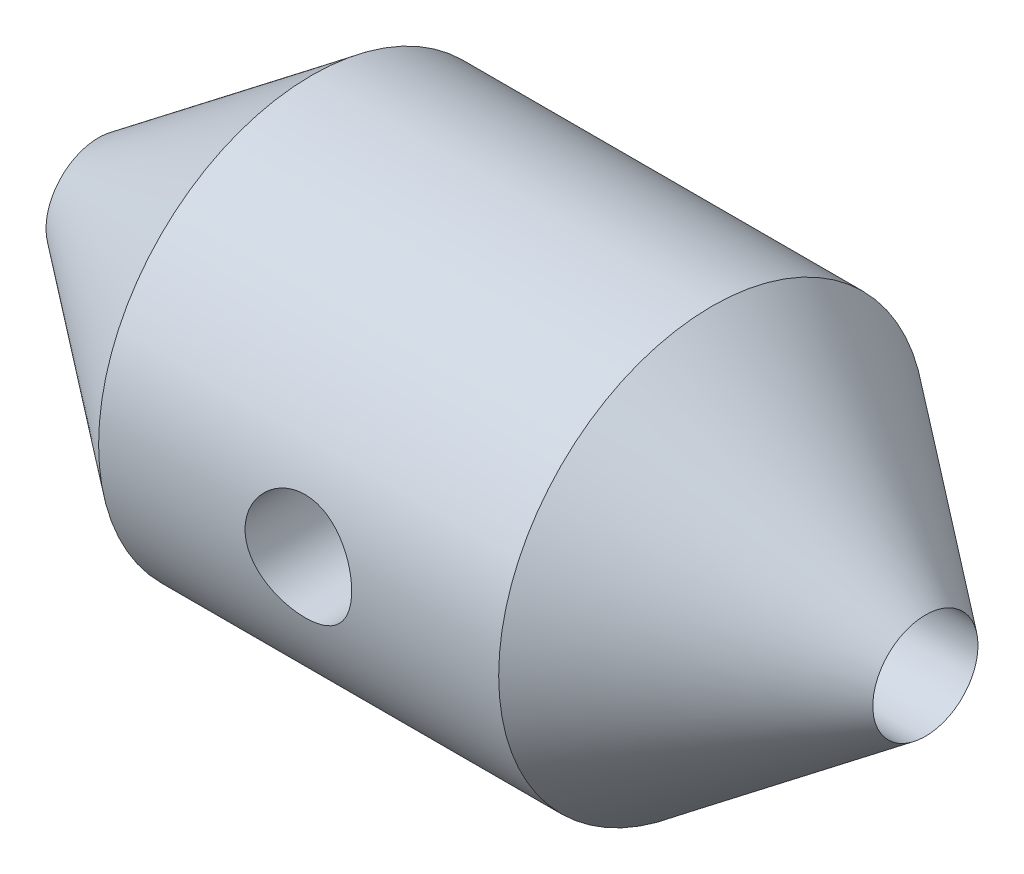
from build123d import *

# Parameters (mm, degrees)
SKETCH1_R           = 101.6
SKETCH1_R_2         = 25.4
BOSS_EXTRUDE1_DEPTH = 190.5
SKETCH2_R           = 101.6
BOSS_EXTRUDE2_DEPTH = 101.6
BOSS_EXTRUDE2_TAPER = 37
SKETCH3_R           = 101.6
BOSS_EXTRUDE3_DEPTH = 101.6
BOSS_EXTRUDE3_TAPER = 37
SKETCH4_R           = 25.03890851
CUT_EXTRUDE1_DEPTH  = 453.39
SKETCH5_R           = 25.4
CUT_EXTRUDE3_DEPTH  = 351.79


with BuildPart() as part:
    # Sketch1 → Boss-Extrude1 (new body)
    with BuildSketch(Plane(origin=(0, 0, 0), x_dir=(0, 0, -1), z_dir=(1, 0, 0))):
        Circle(SKETCH1_R)
        Circle(SKETCH1_R_2, mode=Mode.SUBTRACT)
    extrude(amount=BOSS_EXTRUDE1_DEPTH)

    # Sketch2 → Boss-Extrude2 (add)
    with BuildSketch(Plane(origin=(190.5, 0, 0), x_dir=(0, 0, -1), z_dir=(1, 0, 0))):
        Circle(SKETCH2_R)
    extrude(amount=BOSS_EXTRUDE2_DEPTH, taper=BOSS_EXTRUDE2_TAPER)

    # Sketch3 → Boss-Extrude3 (add)
    with BuildSketch(Plane.ZY):
        Circle(SKETCH3_R)
    extrude(amount=BOSS_EXTRUDE3_DEPTH, taper=BOSS_EXTRUDE3_TAPER)

    # Sketch4 → Cut-Extrude1 (cut)
    with BuildSketch(Plane.ZY.offset(101.6)):
        with Locations(Location((0, 0, 0), (0, 0, 180))):
            Circle(SKETCH4_R)
    extrude(amount=-CUT_EXTRUDE1_DEPTH, mode=Mode.SUBTRACT)

    # Sketch5 → Cut-Extrude3 (cut)
    with BuildSketch(Plane.XY.offset(254)):
        with Locations((95.115505382, 0)):
            Circle(SKETCH5_R)
    extrude(amount=-CUT_EXTRUDE3_DEPTH, mode=Mode.SUBTRACT)


solid = part.part
